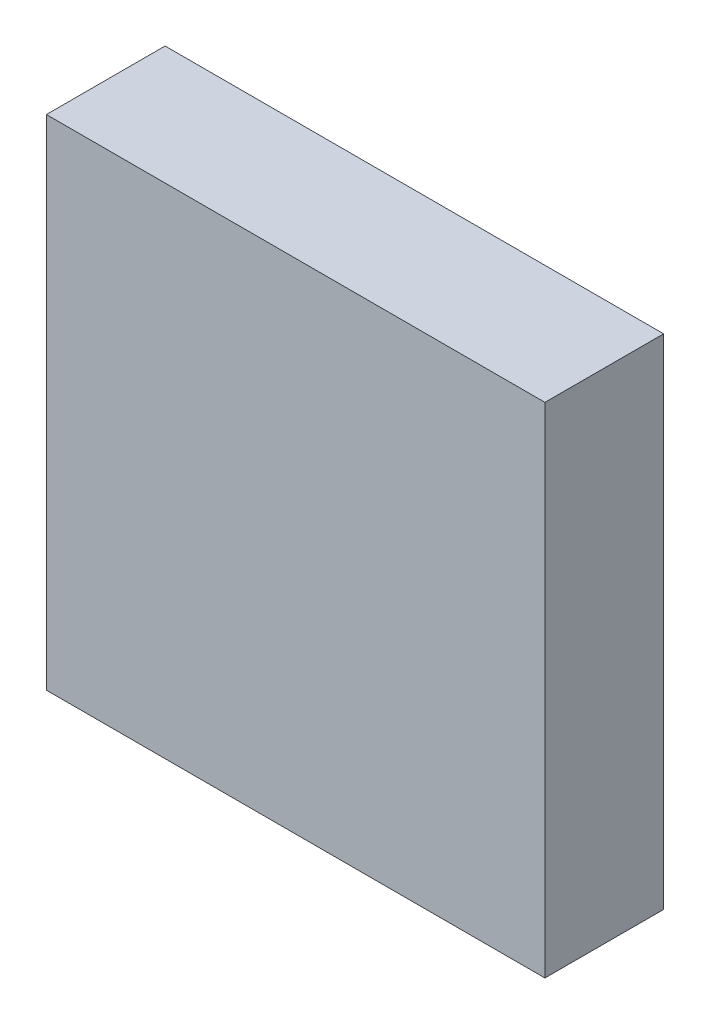
from build123d import *

# Parameters (mm, degrees)
SKETCH1_W     = 21
SKETCH1_H     = 21
PROFILE_DEPTH = 5


with BuildPart() as part:
    # Sketch1 → Profile (new body)
    with BuildSketch(Plane.XY):
        with Locations((10.5, 10.5)):
            Rectangle(SKETCH1_W, SKETCH1_H)
    extrude(amount=PROFILE_DEPTH)


solid = part.part
